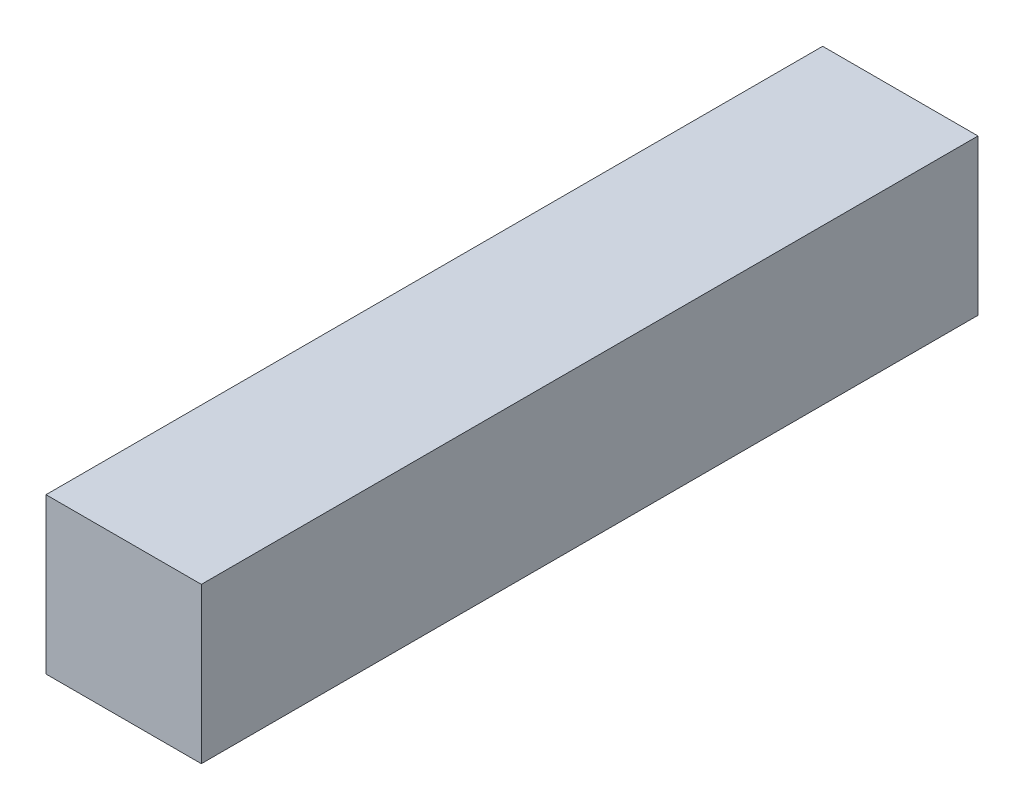
from build123d import *

# Parameters (mm, degrees)
SKETCH1_W           = 5
SKETCH1_H           = 5
BOSS_EXTRUDE1_DEPTH = 25


with BuildPart() as part:
    # Sketch1 → Boss-Extrude1 (new body)
    with BuildSketch(Plane.XY):
        Rectangle(SKETCH1_W, SKETCH1_H)
    extrude(amount=BOSS_EXTRUDE1_DEPTH)


solid = part.part
